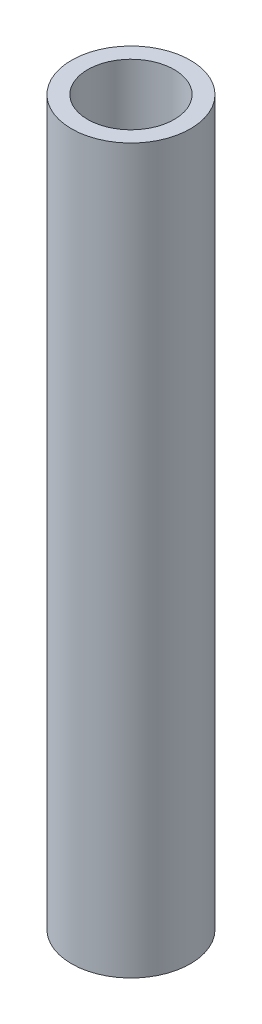
from build123d import *

# Parameters (mm, degrees)
SKETCH1_R           = 16.7005
SKETCH1_R_2         = 12.1539
BOSS_EXTRUDE1_DEPTH = 101.6


with BuildPart() as part:
    # Sketch1 → Boss-Extrude1 (new, symmetric)
    with BuildSketch(Plane(origin=(0, 0, 0), x_dir=(1, 0, 0), z_dir=(0, 1, 0))):
        with Locations(Location((0, 0, 0), (0, 0, 270))):
            Circle(SKETCH1_R)
        with Locations(Location((0, 0, 0), (0, 0, 270))):
            Circle(SKETCH1_R_2, mode=Mode.SUBTRACT)
    extrude(amount=BOSS_EXTRUDE1_DEPTH, both=True)


solid = part.part
